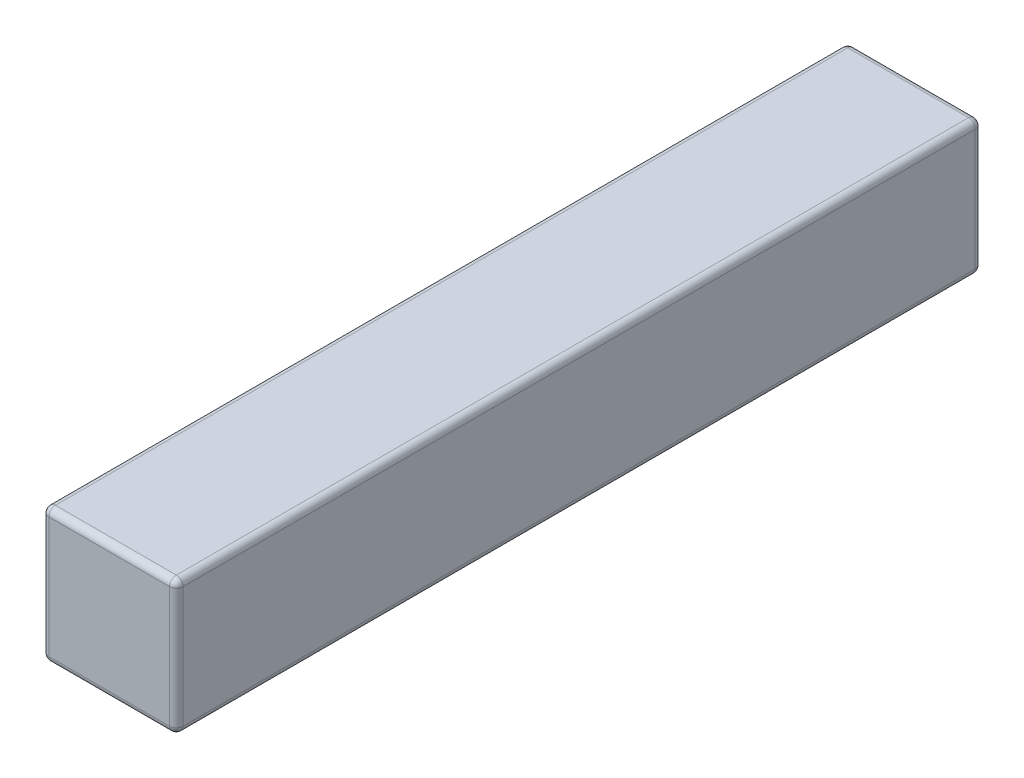
from build123d import *

# Parameters (mm, degrees)
SKETCH2_W           = 50.8
SKETCH2_H           = 50.8
BOSS_EXTRUDE1_DEPTH = 304.8
FILLET1_R           = 2.54
SKETCH3_W           = 6.594230769
SKETCH3_H           = 3.175
BOSS_EXTRUDE2_DEPTH = 1.27


with BuildPart() as part:
    # Sketch2 → Boss-Extrude1 (new body)
    with BuildSketch(Plane.XY):
        with Locations((25.4, 25.4)):
            Rectangle(SKETCH2_W, SKETCH2_H)
    extrude(amount=BOSS_EXTRUDE1_DEPTH)

    # Fillet1
    fillet1_edges = [part.edges().sort_by_distance(p)[0] for p in [
        (50.8, 25.4, 304.8),
        (25.4, 50.8, 304.8),
        (0, 25.4, 304.8),
        (25.4, 50.8, 0),
        (50.8, 25.4, 0),
        (25.4, 0, 0),
        (0, 25.4, 0),
        (0, 50.8, 152.4),
        (50.8, 50.8, 152.4),
        (50.8, 0, 152.4),
        (0, 0, 152.4),
        (25.4, 0, 304.8),
    ]]
    fillet(fillet1_edges, radius=FILLET1_R)

    # Sketch3 → Boss-Extrude2 (add)
    with BuildSketch(Plane(origin=(0, 0, 0), x_dir=(-1, 0, 0), z_dir=(0, 0, -1))):
        Polygon((-39.327558634, 28.023350903), (-39.327558634, 32.663735519), (-36.152558634, 32.663735519), (-36.152558634, 28.023350903), (-31.267943249, 28.023350903), (-31.267943249, 24.848350903), (-36.152558634, 24.848350903), (-36.152558634, 20.207966288), (-39.327558634, 20.207966288), (-39.327558634, 24.848350903), (-44.212174018, 24.848350903), (-44.212174018, 28.023350903), align=None)
        with Locations((-9.653520173, 24.23777398)):
            Rectangle(SKETCH3_W, SKETCH3_H)
    extrude(amount=BOSS_EXTRUDE2_DEPTH)


solid = part.part
